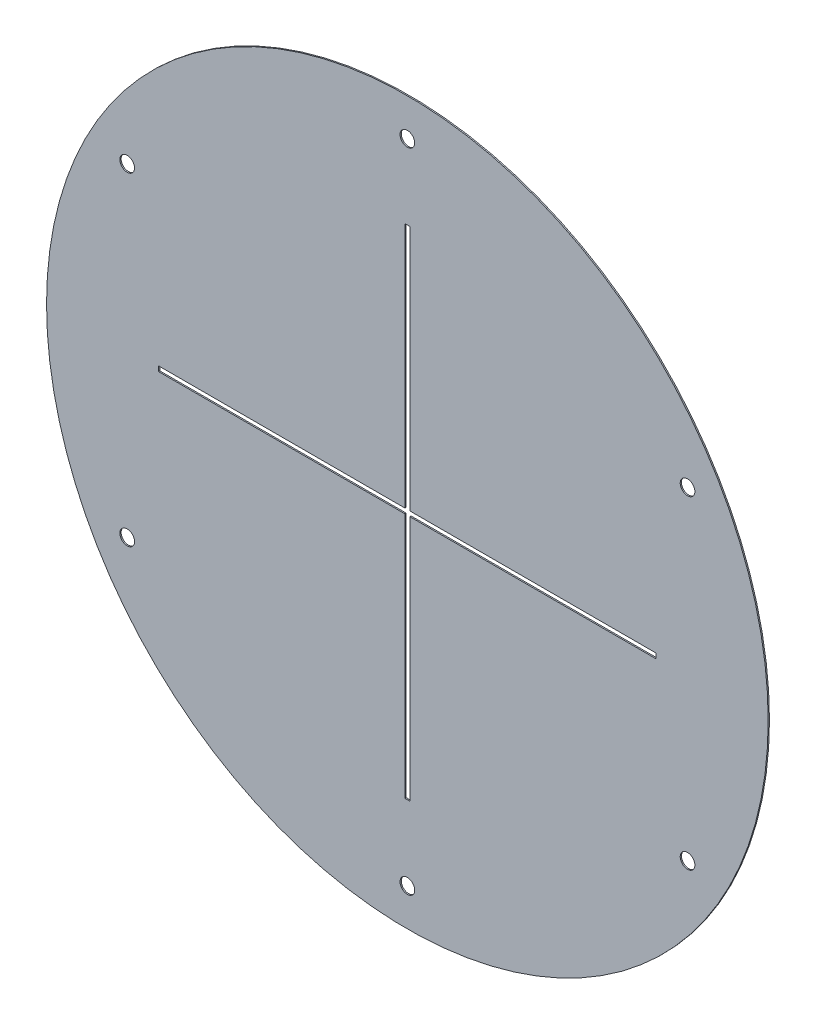
from build123d import *

# Parameters (mm, degrees)
SKETCH2_R           = 72.5
SKETCH2_R_2         = 1.4732
BOSS_EXTRUDE3_DEPTH = 0.254


with BuildPart() as part:
    # Sketch2 → Boss-Extrude3 (new body)
    with BuildSketch(Plane.XY):
        Circle(SKETCH2_R)
        with Locations((56.291651246, -32.5)):
            Circle(SKETCH2_R_2, mode=Mode.SUBTRACT)
        with Locations((0, -65)):
            Circle(SKETCH2_R_2, mode=Mode.SUBTRACT)
        with Locations((-56.291651246, -32.5)):
            Circle(SKETCH2_R_2, mode=Mode.SUBTRACT)
        with Locations((-56.291651246, 32.5)):
            Circle(SKETCH2_R_2, mode=Mode.SUBTRACT)
        with Locations((0, 65)):
            Circle(SKETCH2_R_2, mode=Mode.SUBTRACT)
        with Locations((56.291651246, 32.5)):
            Circle(SKETCH2_R_2, mode=Mode.SUBTRACT)
        Polygon((-0.5, 50), (-0.5, 0.5), (-50, 0.5), (-50, -0.5), (-0.5, -0.5), (-0.5, -50), (0.5, -50), (0.5, -0.5), (50, -0.5), (50, 0.5), (0.5, 0.5), (0.5, 50), align=None, mode=Mode.SUBTRACT)
    extrude(amount=BOSS_EXTRUDE3_DEPTH)


solid = part.part
